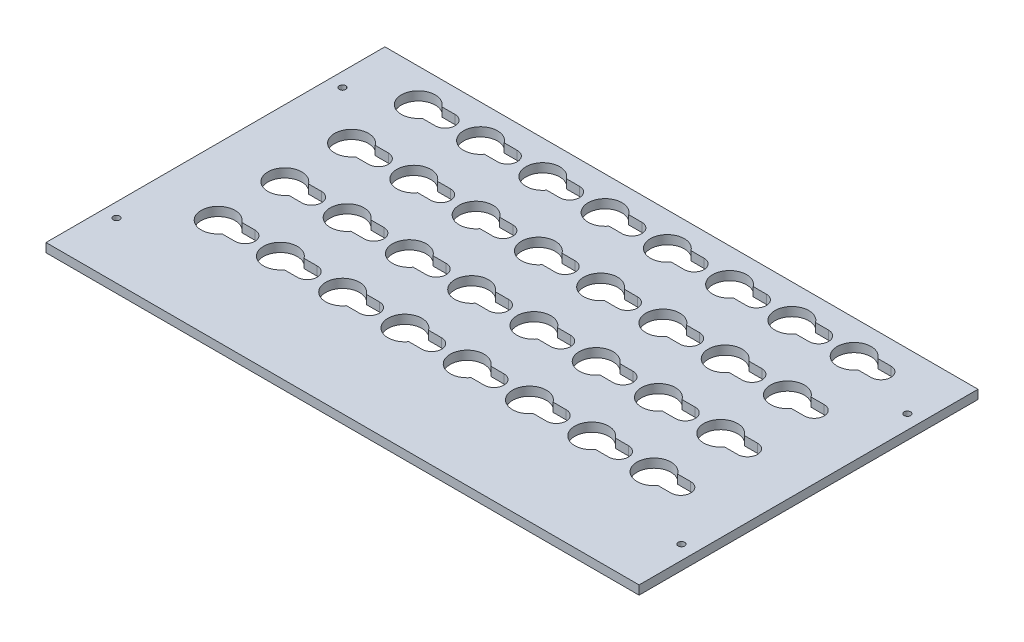
from build123d import *

# Parameters (mm, degrees)
SKETCH1_W           = 266.7
SKETCH1_H           = 152.4
SKETCH1_R           = 1.4732
BOSS_EXTRUDE1_DEPTH = 4


with BuildPart() as part:
    # Sketch1 → Boss-Extrude1 (new body)
    with BuildSketch(Plane(origin=(0, 0, 0), x_dir=(1, 0, 0), z_dir=(0, 1, 0))):
        with Locations((133.35, -76.2)):
            Rectangle(SKETCH1_W, SKETCH1_H)
        with Locations(Location((6.35, -127, 0), (0, 0, 270))):
            Circle(SKETCH1_R, mode=Mode.SUBTRACT)
        with BuildLine():
            ThreePointArc((36.189214409, -109.445), (22.38, -105), (36.189214409, -100.555))
            Line((36.189214409, -100.555), (42.065, -100.555))
            ThreePointArc((42.065, -100.555), (45.208089642, -101.856910358), (46.51, -105))
            ThreePointArc((46.51, -105), (45.208089642, -108.143089642), (42.065, -109.445))
            Line((42.065, -109.445), (36.189214409, -109.445))
        make_face(mode=Mode.SUBTRACT)
        with BuildLine():
            ThreePointArc((64.189214409, -109.445), (50.38, -105), (64.189214409, -100.555))
            Line((64.189214409, -100.555), (70.065, -100.555))
            ThreePointArc((70.065, -100.555), (73.208089642, -101.856910358), (74.51, -105))
            ThreePointArc((74.51, -105), (73.208089642, -108.143089642), (70.065, -109.445))
            Line((70.065, -109.445), (64.189214409, -109.445))
        make_face(mode=Mode.SUBTRACT)
        with BuildLine():
            ThreePointArc((92.189214409, -109.445), (78.38, -105), (92.189214409, -100.555))
            Line((92.189214409, -100.555), (98.065, -100.555))
            ThreePointArc((98.065, -100.555), (101.208089642, -101.856910358), (102.51, -105))
            ThreePointArc((102.51, -105), (101.208089642, -108.143089642), (98.065, -109.445))
            Line((98.065, -109.445), (92.189214409, -109.445))
        make_face(mode=Mode.SUBTRACT)
        with BuildLine():
            ThreePointArc((120.189214409, -109.445), (106.38, -105), (120.189214409, -100.555))
            Line((120.189214409, -100.555), (126.065, -100.555))
            ThreePointArc((126.065, -100.555), (129.208089642, -101.856910358), (130.51, -105))
            ThreePointArc((130.51, -105), (129.208089642, -108.143089642), (126.065, -109.445))
            Line((126.065, -109.445), (120.189214409, -109.445))
        make_face(mode=Mode.SUBTRACT)
        with Locations(Location((260.35, -127, 0), (0, 0, 270))):
            Circle(SKETCH1_R, mode=Mode.SUBTRACT)
        with BuildLine():
            ThreePointArc((148.189214409, -109.445), (134.38, -105), (148.189214409, -100.555))
            Line((148.189214409, -100.555), (154.065, -100.555))
            ThreePointArc((154.065, -100.555), (157.208089642, -101.856910358), (158.51, -105))
            ThreePointArc((158.51, -105), (157.208089642, -108.143089642), (154.065, -109.445))
            Line((154.065, -109.445), (148.189214409, -109.445))
        make_face(mode=Mode.SUBTRACT)
        with BuildLine():
            ThreePointArc((176.189214409, -109.445), (162.38, -105), (176.189214409, -100.555))
            Line((176.189214409, -100.555), (182.065, -100.555))
            ThreePointArc((182.065, -100.555), (185.208089642, -101.856910358), (186.51, -105))
            ThreePointArc((186.51, -105), (185.208089642, -108.143089642), (182.065, -109.445))
            Line((182.065, -109.445), (176.189214409, -109.445))
        make_face(mode=Mode.SUBTRACT)
        with BuildLine():
            ThreePointArc((204.189214409, -109.445), (190.38, -105), (204.189214409, -100.555))
            Line((204.189214409, -100.555), (210.065, -100.555))
            ThreePointArc((210.065, -100.555), (213.208089642, -101.856910358), (214.51, -105))
            ThreePointArc((214.51, -105), (213.208089642, -108.143089642), (210.065, -109.445))
            Line((210.065, -109.445), (204.189214409, -109.445))
        make_face(mode=Mode.SUBTRACT)
        with BuildLine():
            ThreePointArc((232.189214409, -109.445), (218.38, -105), (232.189214409, -100.555))
            Line((232.189214409, -100.555), (238.065, -100.555))
            ThreePointArc((238.065, -100.555), (241.208089642, -101.856910358), (242.51, -105))
            ThreePointArc((242.51, -105), (241.208089642, -108.143089642), (238.065, -109.445))
            Line((238.065, -109.445), (232.189214409, -109.445))
        make_face(mode=Mode.SUBTRACT)
        with BuildLine():
            ThreePointArc((36.189214409, -79.445), (22.38, -75), (36.189214409, -70.555))
            Line((36.189214409, -70.555), (42.065, -70.555))
            ThreePointArc((42.065, -70.555), (45.208089642, -71.856910358), (46.51, -75))
            ThreePointArc((46.51, -75), (45.208089642, -78.143089642), (42.065, -79.445))
            Line((42.065, -79.445), (36.189214409, -79.445))
        make_face(mode=Mode.SUBTRACT)
        with BuildLine():
            ThreePointArc((64.189214409, -79.445), (50.38, -75), (64.189214409, -70.555))
            Line((64.189214409, -70.555), (70.065, -70.555))
            ThreePointArc((70.065, -70.555), (73.208089642, -71.856910358), (74.51, -75))
            ThreePointArc((74.51, -75), (73.208089642, -78.143089642), (70.065, -79.445))
            Line((70.065, -79.445), (64.189214409, -79.445))
        make_face(mode=Mode.SUBTRACT)
        with BuildLine():
            ThreePointArc((36.189214409, -49.445), (22.38, -45), (36.189214409, -40.555))
            Line((36.189214409, -40.555), (42.065, -40.555))
            ThreePointArc((42.065, -40.555), (45.208089642, -41.856910358), (46.51, -45))
            ThreePointArc((46.51, -45), (45.208089642, -48.143089642), (42.065, -49.445))
            Line((42.065, -49.445), (36.189214409, -49.445))
        make_face(mode=Mode.SUBTRACT)
        with BuildLine():
            ThreePointArc((64.189214409, -49.445), (50.38, -45), (64.189214409, -40.555))
            Line((64.189214409, -40.555), (70.065, -40.555))
            ThreePointArc((70.065, -40.555), (73.208089642, -41.856910358), (74.51, -45))
            ThreePointArc((74.51, -45), (73.208089642, -48.143089642), (70.065, -49.445))
            Line((70.065, -49.445), (64.189214409, -49.445))
        make_face(mode=Mode.SUBTRACT)
        with BuildLine():
            ThreePointArc((92.189214409, -79.445), (78.38, -75), (92.189214409, -70.555))
            Line((92.189214409, -70.555), (98.065, -70.555))
            ThreePointArc((98.065, -70.555), (101.208089642, -71.856910358), (102.51, -75))
            ThreePointArc((102.51, -75), (101.208089642, -78.143089642), (98.065, -79.445))
            Line((98.065, -79.445), (92.189214409, -79.445))
        make_face(mode=Mode.SUBTRACT)
        with BuildLine():
            ThreePointArc((120.189214409, -79.445), (106.38, -75), (120.189214409, -70.555))
            Line((120.189214409, -70.555), (126.065, -70.555))
            ThreePointArc((126.065, -70.555), (129.208089642, -71.856910358), (130.51, -75))
            ThreePointArc((130.51, -75), (129.208089642, -78.143089642), (126.065, -79.445))
            Line((126.065, -79.445), (120.189214409, -79.445))
        make_face(mode=Mode.SUBTRACT)
        with BuildLine():
            ThreePointArc((92.189214409, -49.445), (78.38, -45), (92.189214409, -40.555))
            Line((92.189214409, -40.555), (98.065, -40.555))
            ThreePointArc((98.065, -40.555), (101.208089642, -41.856910358), (102.51, -45))
            ThreePointArc((102.51, -45), (101.208089642, -48.143089642), (98.065, -49.445))
            Line((98.065, -49.445), (92.189214409, -49.445))
        make_face(mode=Mode.SUBTRACT)
        with BuildLine():
            ThreePointArc((120.189214409, -49.445), (106.38, -45), (120.189214409, -40.555))
            Line((120.189214409, -40.555), (126.065, -40.555))
            ThreePointArc((126.065, -40.555), (129.208089642, -41.856910358), (130.51, -45))
            ThreePointArc((130.51, -45), (129.208089642, -48.143089642), (126.065, -49.445))
            Line((126.065, -49.445), (120.189214409, -49.445))
        make_face(mode=Mode.SUBTRACT)
        with Locations(Location((6.35, -25.4, 0), (0, 0, 270))):
            Circle(SKETCH1_R, mode=Mode.SUBTRACT)
        with BuildLine():
            ThreePointArc((36.189214409, -19.445), (22.38, -15), (36.189214409, -10.555))
            Line((36.189214409, -10.555), (42.065, -10.555))
            ThreePointArc((42.065, -10.555), (45.208089642, -11.856910358), (46.51, -15))
            ThreePointArc((46.51, -15), (45.208089642, -18.143089642), (42.065, -19.445))
            Line((42.065, -19.445), (36.189214409, -19.445))
        make_face(mode=Mode.SUBTRACT)
        with BuildLine():
            ThreePointArc((64.189214409, -19.445), (50.38, -15), (64.189214409, -10.555))
            Line((64.189214409, -10.555), (70.065, -10.555))
            ThreePointArc((70.065, -10.555), (73.208089642, -11.856910358), (74.51, -15))
            ThreePointArc((74.51, -15), (73.208089642, -18.143089642), (70.065, -19.445))
            Line((70.065, -19.445), (64.189214409, -19.445))
        make_face(mode=Mode.SUBTRACT)
        with BuildLine():
            ThreePointArc((92.189214409, -19.445), (78.38, -15), (92.189214409, -10.555))
            Line((92.189214409, -10.555), (98.065, -10.555))
            ThreePointArc((98.065, -10.555), (101.208089642, -11.856910358), (102.51, -15))
            ThreePointArc((102.51, -15), (101.208089642, -18.143089642), (98.065, -19.445))
            Line((98.065, -19.445), (92.189214409, -19.445))
        make_face(mode=Mode.SUBTRACT)
        with BuildLine():
            ThreePointArc((120.189214409, -19.445), (106.38, -15), (120.189214409, -10.555))
            Line((120.189214409, -10.555), (126.065, -10.555))
            ThreePointArc((126.065, -10.555), (129.208089642, -11.856910358), (130.51, -15))
            ThreePointArc((130.51, -15), (129.208089642, -18.143089642), (126.065, -19.445))
            Line((126.065, -19.445), (120.189214409, -19.445))
        make_face(mode=Mode.SUBTRACT)
        with BuildLine():
            ThreePointArc((148.189214409, -79.445), (134.38, -75), (148.189214409, -70.555))
            Line((148.189214409, -70.555), (154.065, -70.555))
            ThreePointArc((154.065, -70.555), (157.208089642, -71.856910358), (158.51, -75))
            ThreePointArc((158.51, -75), (157.208089642, -78.143089642), (154.065, -79.445))
            Line((154.065, -79.445), (148.189214409, -79.445))
        make_face(mode=Mode.SUBTRACT)
        with BuildLine():
            ThreePointArc((176.189214409, -79.445), (162.38, -75), (176.189214409, -70.555))
            Line((176.189214409, -70.555), (182.065, -70.555))
            ThreePointArc((182.065, -70.555), (185.208089642, -71.856910358), (186.51, -75))
            ThreePointArc((186.51, -75), (185.208089642, -78.143089642), (182.065, -79.445))
            Line((182.065, -79.445), (176.189214409, -79.445))
        make_face(mode=Mode.SUBTRACT)
        with BuildLine():
            ThreePointArc((148.189214409, -49.445), (134.38, -45), (148.189214409, -40.555))
            Line((148.189214409, -40.555), (154.065, -40.555))
            ThreePointArc((154.065, -40.555), (157.208089642, -41.856910358), (158.51, -45))
            ThreePointArc((158.51, -45), (157.208089642, -48.143089642), (154.065, -49.445))
            Line((154.065, -49.445), (148.189214409, -49.445))
        make_face(mode=Mode.SUBTRACT)
        with BuildLine():
            ThreePointArc((176.189214409, -49.445), (162.38, -45), (176.189214409, -40.555))
            Line((176.189214409, -40.555), (182.065, -40.555))
            ThreePointArc((182.065, -40.555), (185.208089642, -41.856910358), (186.51, -45))
            ThreePointArc((186.51, -45), (185.208089642, -48.143089642), (182.065, -49.445))
            Line((182.065, -49.445), (176.189214409, -49.445))
        make_face(mode=Mode.SUBTRACT)
        with BuildLine():
            ThreePointArc((204.189214409, -79.445), (190.38, -75), (204.189214409, -70.555))
            Line((204.189214409, -70.555), (210.065, -70.555))
            ThreePointArc((210.065, -70.555), (213.208089642, -71.856910358), (214.51, -75))
            ThreePointArc((214.51, -75), (213.208089642, -78.143089642), (210.065, -79.445))
            Line((210.065, -79.445), (204.189214409, -79.445))
        make_face(mode=Mode.SUBTRACT)
        with BuildLine():
            ThreePointArc((232.189214409, -79.445), (218.38, -75), (232.189214409, -70.555))
            Line((232.189214409, -70.555), (238.065, -70.555))
            ThreePointArc((238.065, -70.555), (241.208089642, -71.856910358), (242.51, -75))
            ThreePointArc((242.51, -75), (241.208089642, -78.143089642), (238.065, -79.445))
            Line((238.065, -79.445), (232.189214409, -79.445))
        make_face(mode=Mode.SUBTRACT)
        with BuildLine():
            ThreePointArc((204.189214409, -49.445), (190.38, -45), (204.189214409, -40.555))
            Line((204.189214409, -40.555), (210.065, -40.555))
            ThreePointArc((210.065, -40.555), (213.208089642, -41.856910358), (214.51, -45))
            ThreePointArc((214.51, -45), (213.208089642, -48.143089642), (210.065, -49.445))
            Line((210.065, -49.445), (204.189214409, -49.445))
        make_face(mode=Mode.SUBTRACT)
        with BuildLine():
            ThreePointArc((232.189214409, -49.445), (218.38, -45), (232.189214409, -40.555))
            Line((232.189214409, -40.555), (238.065, -40.555))
            ThreePointArc((238.065, -40.555), (241.208089642, -41.856910358), (242.51, -45))
            ThreePointArc((242.51, -45), (241.208089642, -48.143089642), (238.065, -49.445))
            Line((238.065, -49.445), (232.189214409, -49.445))
        make_face(mode=Mode.SUBTRACT)
        with BuildLine():
            ThreePointArc((148.189214409, -19.445), (134.38, -15), (148.189214409, -10.555))
            Line((148.189214409, -10.555), (154.065, -10.555))
            ThreePointArc((154.065, -10.555), (157.208089642, -11.856910358), (158.51, -15))
            ThreePointArc((158.51, -15), (157.208089642, -18.143089642), (154.065, -19.445))
            Line((154.065, -19.445), (148.189214409, -19.445))
        make_face(mode=Mode.SUBTRACT)
        with BuildLine():
            ThreePointArc((176.189214409, -19.445), (162.38, -15), (176.189214409, -10.555))
            Line((176.189214409, -10.555), (182.065, -10.555))
            ThreePointArc((182.065, -10.555), (185.208089642, -11.856910358), (186.51, -15))
            ThreePointArc((186.51, -15), (185.208089642, -18.143089642), (182.065, -19.445))
            Line((182.065, -19.445), (176.189214409, -19.445))
        make_face(mode=Mode.SUBTRACT)
        with Locations(Location((260.35, -25.4, 0), (0, 0, 270))):
            Circle(SKETCH1_R, mode=Mode.SUBTRACT)
        with BuildLine():
            ThreePointArc((204.189214409, -19.445), (190.38, -15), (204.189214409, -10.555))
            Line((204.189214409, -10.555), (210.065, -10.555))
            ThreePointArc((210.065, -10.555), (213.208089642, -11.856910358), (214.51, -15))
            ThreePointArc((214.51, -15), (213.208089642, -18.143089642), (210.065, -19.445))
            Line((210.065, -19.445), (204.189214409, -19.445))
        make_face(mode=Mode.SUBTRACT)
        with BuildLine():
            ThreePointArc((232.189214409, -19.445), (218.38, -15), (232.189214409, -10.555))
            Line((232.189214409, -10.555), (238.065, -10.555))
            ThreePointArc((238.065, -10.555), (241.208089642, -11.856910358), (242.51, -15))
            ThreePointArc((242.51, -15), (241.208089642, -18.143089642), (238.065, -19.445))
            Line((238.065, -19.445), (232.189214409, -19.445))
        make_face(mode=Mode.SUBTRACT)
    extrude(amount=BOSS_EXTRUDE1_DEPTH)


solid = part.part
